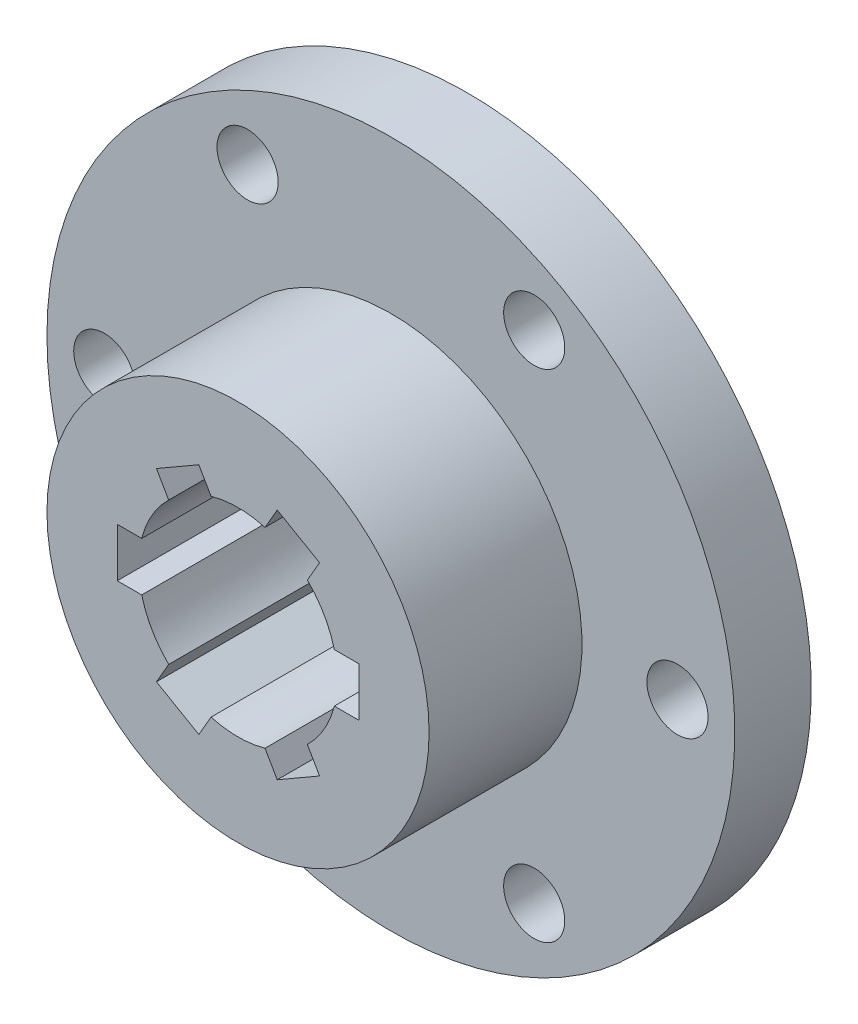
from build123d import *

# Parameters (mm, degrees)
SKETCH1_R           = 15.875
BOSS_EXTRUDE1_DEPTH = 12.7
SKETCH4_R           = 28.575
BOSS_EXTRUDE3_DEPTH = 6.35
CUT_EXTRUDE2_DEPTH  = 19.05
SKETCH6_R           = 2.54
CUT_EXTRUDE3_DEPTH  = 6.35


with BuildPart() as part:
    # Sketch1 → Boss-Extrude1 (new body)
    with BuildSketch(Plane.XY):
        Circle(SKETCH1_R)
    extrude(amount=BOSS_EXTRUDE1_DEPTH)

    # Sketch4 → Boss-Extrude3 (add)
    with BuildSketch(Plane(origin=(0, 0, 0), x_dir=(-1, 0, 0), z_dir=(0, 0, -1))):
        Circle(SKETCH4_R)
    extrude(amount=BOSS_EXTRUDE3_DEPTH)

    # Sketch5 → Cut-Extrude2 (cut)
    with BuildSketch(Plane.XY.offset(12.7)):
        with BuildLine():
            Line((6.77626362, -7.672832876), (5.76026362, -5.913069256))
            ThreePointArc((5.76026362, -5.913069256), (7.149039708, -4.1275), (8.001, -2.032))
            Line((8.001, -2.032), (10.033, -2.032))
            Line((10.033, -2.032), (10.033, 2.032))
            Line((10.033, 2.032), (8.001, 2.032))
            ThreePointArc((8.001, 2.032), (7.149039708, 4.1275), (5.76026362, 5.913069256))
            Line((5.76026362, 5.913069256), (6.77626362, 7.672832876))
            Line((6.77626362, 7.672832876), (3.25673638, 9.704832876))
            Line((3.25673638, 9.704832876), (2.24073638, 7.945069256))
            ThreePointArc((2.24073638, 7.945069256), (0, 8.255), (-2.24073638, 7.945069256))
            Line((-2.24073638, 7.945069256), (-3.25673638, 9.704832876))
            Line((-3.25673638, 9.704832876), (-6.77626362, 7.672832876))
            Line((-6.77626362, 7.672832876), (-5.76026362, 5.913069256))
            ThreePointArc((-5.76026362, 5.913069256), (-7.149039708, 4.1275), (-8.001, 2.032))
            Line((-8.001, 2.032), (-10.033, 2.032))
            Line((-10.033, 2.032), (-10.033, -2.032))
            Line((-10.033, -2.032), (-8.001, -2.032))
            ThreePointArc((-8.001, -2.032), (-7.149039708, -4.1275), (-5.76026362, -5.913069256))
            Line((-5.76026362, -5.913069256), (-6.77626362, -7.672832876))
            Line((-6.77626362, -7.672832876), (-3.25673638, -9.704832876))
            Line((-3.25673638, -9.704832876), (-2.24073638, -7.945069256))
            ThreePointArc((-2.24073638, -7.945069256), (0, -8.255), (2.24073638, -7.945069256))
            Line((2.24073638, -7.945069256), (3.25673638, -9.704832876))
            Line((3.25673638, -9.704832876), (6.77626362, -7.672832876))
        make_face()
    extrude(amount=-CUT_EXTRUDE2_DEPTH, mode=Mode.SUBTRACT)

    # Sketch6 → Cut-Extrude3 (cut)
    with BuildSketch(Plane(origin=(0, 0, -6.35), x_dir=(-1, 0, 0), z_dir=(0, 0, -1))):
        with Locations((-23.8125, 0)):
            Circle(SKETCH6_R)
        with Locations((-11.90625, 20.622229928)):
            Circle(SKETCH6_R)
        with Locations((11.90625, 20.622229928)):
            Circle(SKETCH6_R)
        with Locations((23.8125, 0)):
            Circle(SKETCH6_R)
        with Locations((11.90625, -20.622229928)):
            Circle(SKETCH6_R)
        with Locations((-11.90625, -20.622229928)):
            Circle(SKETCH6_R)
    extrude(amount=-CUT_EXTRUDE3_DEPTH, mode=Mode.SUBTRACT)


solid = part.part
